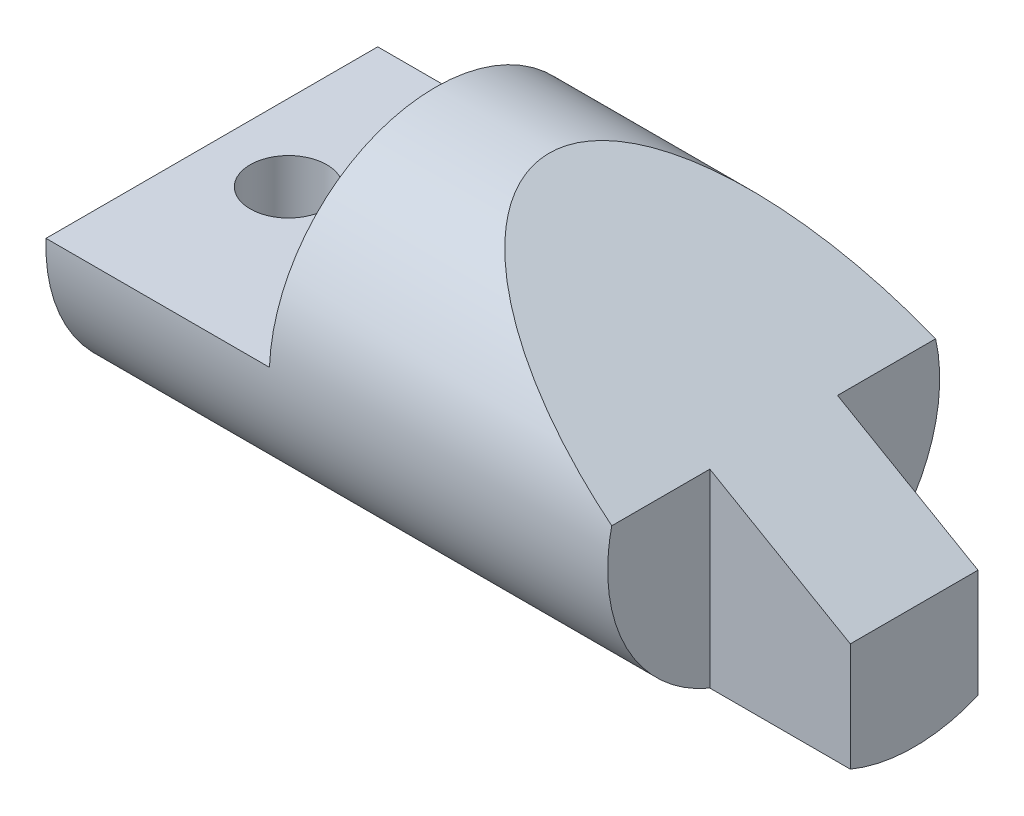
from build123d import *

# Parameters (mm, degrees)
SKETCH2_R                           = 26
BOSS_EXTRUDE1_DEPTH                 = 110
CUT_EXTRUDE1_REACH                  = 117.983
CUT_EXTRUDE1_END_RADIUS             = 26
SKETCH3_W                           = 35
SKETCH3_H                           = 25
CUT_EXTRUDE1_DIRECTION_2_REACH      = 117.983
CUT_EXTRUDE1_DIRECTION_2_END_RADIUS = 26
CUT_EXTRUDE2_REACH                  = 118.211
CUT_EXTRUDE2_END_RADIUS             = 26
SKETCH4_R                           = 6
CUT_EXTRUDE4_REACH                  = 117.983
SKETCH6_W                           = 22
SKETCH6_H                           = 16
CUT_EXTRUDE4_DIRECTION_2_REACH      = 117.983


with BuildPart() as part:
    # Sketch2 → Boss-Extrude1 (new body)
    with BuildSketch(Plane(origin=(0, 0, 0), x_dir=(0, 0, -1), z_dir=(1, 0, 0))):
        Circle(SKETCH2_R)
    extrude(amount=BOSS_EXTRUDE1_DEPTH)

    # Cut-Extrude1: up to this cylinder (the profile starts inside it)
    cut_extrude1_end = Plane(origin=(54.2237205, 0, 0), z_dir=(-1, 0, 0)) * Cylinder(CUT_EXTRUDE1_END_RADIUS, 362.413441, mode=Mode.PRIVATE)
    # Sketch3 → Cut-Extrude1 (cut, up to the surface)
    with BuildSketch(Plane.XY, mode=Mode.PRIVATE) as cut_extrude1_sk1:
        with Locations((17.5, 13.5)):
            Rectangle(SKETCH3_W, SKETCH3_H)
    cut_extrude1_tool1 = extrude(cut_extrude1_sk1.sketch, amount=-CUT_EXTRUDE1_REACH, mode=Mode.PRIVATE) & cut_extrude1_end
    add(cut_extrude1_tool1.solids().sort_by_distance((17.5, 13.5, 0))[0], mode=Mode.SUBTRACT)
    # Sketch3 → Cut-Extrude1 (cut, up to the surface)
    with BuildSketch(Plane.XY, mode=Mode.PRIVATE) as cut_extrude1_sk2:
        Polygon((52.84232335, 26), (110, -7), (110, 26), align=None)
    cut_extrude1_tool2 = extrude(cut_extrude1_sk2.sketch, amount=-CUT_EXTRUDE1_REACH, mode=Mode.PRIVATE) & cut_extrude1_end
    add(cut_extrude1_tool2.solids().sort_by_distance((90.947441, 15, 0))[0], mode=Mode.SUBTRACT)

    # Cut-Extrude1 direction 2: up to this cylinder (the profile starts inside it)
    cut_extrude1_direction_2_end = Plane(origin=(54.2237205, 0, 0), z_dir=(-1, 0, 0)) * Cylinder(CUT_EXTRUDE1_DIRECTION_2_END_RADIUS, 362.413441, mode=Mode.PRIVATE)
    # Sketch3 → Cut-Extrude1 direction 2 (cut, up to the surface)
    with BuildSketch(Plane.XY, mode=Mode.PRIVATE) as cut_extrude1_direction_2_sk1:
        with Locations((17.5, 13.5)):
            Rectangle(SKETCH3_W, SKETCH3_H)
    cut_extrude1_direction_2_tool1 = extrude(cut_extrude1_direction_2_sk1.sketch, amount=CUT_EXTRUDE1_DIRECTION_2_REACH, mode=Mode.PRIVATE) & cut_extrude1_direction_2_end
    add(cut_extrude1_direction_2_tool1.solids().sort_by_distance((17.5, 13.5, 0))[0], mode=Mode.SUBTRACT)
    # Sketch3 → Cut-Extrude1 direction 2 (cut, up to the surface)
    with BuildSketch(Plane.XY, mode=Mode.PRIVATE) as cut_extrude1_direction_2_sk2:
        Polygon((52.84232335, 26), (110, -7), (110, 26), align=None)
    cut_extrude1_direction_2_tool2 = extrude(cut_extrude1_direction_2_sk2.sketch, amount=CUT_EXTRUDE1_DIRECTION_2_REACH, mode=Mode.PRIVATE) & cut_extrude1_direction_2_end
    add(cut_extrude1_direction_2_tool2.solids().sort_by_distance((90.947441, 15, 0))[0], mode=Mode.SUBTRACT)

    # Cut-Extrude2: up to this cylinder (the profile starts inside it)
    cut_extrude2_end = Plane(origin=(12, 0, 0), z_dir=(-1, 0, 0)) * Cylinder(CUT_EXTRUDE2_END_RADIUS, 289.422, mode=Mode.PRIVATE)
    # Sketch4 → Cut-Extrude2 (cut, up to the surface)
    with BuildSketch(Plane(origin=(0, 1, 0), x_dir=(1, 0, 0), z_dir=(0, 1, 0)), mode=Mode.PRIVATE) as cut_extrude2_sk1:
        with Locations(Location((12, 0, 0), (0, 0, 270))):
            Circle(SKETCH4_R)
    cut_extrude2_tool1 = extrude(cut_extrude2_sk1.sketch, amount=-CUT_EXTRUDE2_REACH, mode=Mode.PRIVATE) & cut_extrude2_end
    add(cut_extrude2_tool1.solids().sort_by_distance((12, 1, 0))[0], mode=Mode.SUBTRACT)

    # Sketch6 → Cut-Extrude4 (cut, up to next)
    with BuildSketch(Plane(origin=(0, 0, 0), x_dir=(1, 0, 0), z_dir=(0, 1, 0)), mode=Mode.PRIVATE) as cut_extrude4_sk1:
        with Locations((99, 18)):
            Rectangle(SKETCH6_W, SKETCH6_H)
    cut_extrude4_tool1 = extrude(cut_extrude4_sk1.sketch, amount=-CUT_EXTRUDE4_REACH, mode=Mode.PRIVATE) & part.part
    # Sketch6 → Cut-Extrude4 (cut, up to next)
    with BuildSketch(Plane(origin=(0, 0, 0), x_dir=(1, 0, 0), z_dir=(0, 1, 0)), mode=Mode.PRIVATE) as cut_extrude4_sk2:
        with Locations((99, -18)):
            Rectangle(SKETCH6_W, SKETCH6_H)
    cut_extrude4_tool2 = extrude(cut_extrude4_sk2.sketch, amount=-CUT_EXTRUDE4_REACH, mode=Mode.PRIVATE) & part.part
    add(cut_extrude4_tool1.solids().sort_by_distance((99, 0, -18))[0], mode=Mode.SUBTRACT)
    add(cut_extrude4_tool2.solids().sort_by_distance((99, 0, 18))[0], mode=Mode.SUBTRACT)

    # Sketch6 → Cut-Extrude4 direction 2 (cut, up to next)
    with BuildSketch(Plane(origin=(0, 0, 0), x_dir=(1, 0, 0), z_dir=(0, 1, 0)), mode=Mode.PRIVATE) as cut_extrude4_direction_2_sk1:
        with Locations((99, 18)):
            Rectangle(SKETCH6_W, SKETCH6_H)
    cut_extrude4_direction_2_tool1 = extrude(cut_extrude4_direction_2_sk1.sketch, amount=CUT_EXTRUDE4_DIRECTION_2_REACH, mode=Mode.PRIVATE) & part.part
    # Sketch6 → Cut-Extrude4 direction 2 (cut, up to next)
    with BuildSketch(Plane(origin=(0, 0, 0), x_dir=(1, 0, 0), z_dir=(0, 1, 0)), mode=Mode.PRIVATE) as cut_extrude4_direction_2_sk2:
        with Locations((99, -18)):
            Rectangle(SKETCH6_W, SKETCH6_H)
    cut_extrude4_direction_2_tool2 = extrude(cut_extrude4_direction_2_sk2.sketch, amount=CUT_EXTRUDE4_DIRECTION_2_REACH, mode=Mode.PRIVATE) & part.part
    add(cut_extrude4_direction_2_tool1.solids().sort_by_distance((99, 0, -18))[0], mode=Mode.SUBTRACT)
    add(cut_extrude4_direction_2_tool2.solids().sort_by_distance((99, 0, 18))[0], mode=Mode.SUBTRACT)


solid = part.part
